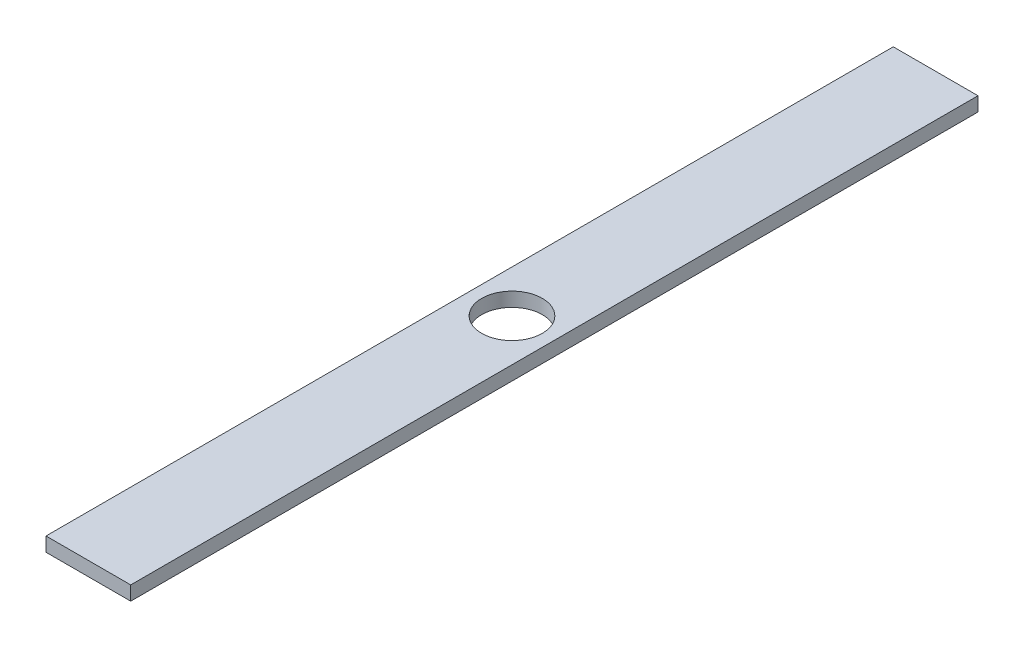
from build123d import *

# Parameters (mm, degrees)
SKETCH1_W           = 38.1
SKETCH1_H           = 381
SKETCH1_R           = 13.631923419
BOSS_EXTRUDE1_DEPTH = 6.35


with BuildPart() as part:
    # Sketch1 → Boss-Extrude1 (new body)
    with BuildSketch(Plane(origin=(0, 0, 0), x_dir=(1, 0, 0), z_dir=(0, 1, 0))):
        Rectangle(SKETCH1_W, SKETCH1_H)
        with Locations(Location((0, 0, 0), (0, 0, 270))):
            Circle(SKETCH1_R, mode=Mode.SUBTRACT)
    extrude(amount=BOSS_EXTRUDE1_DEPTH)


solid = part.part
